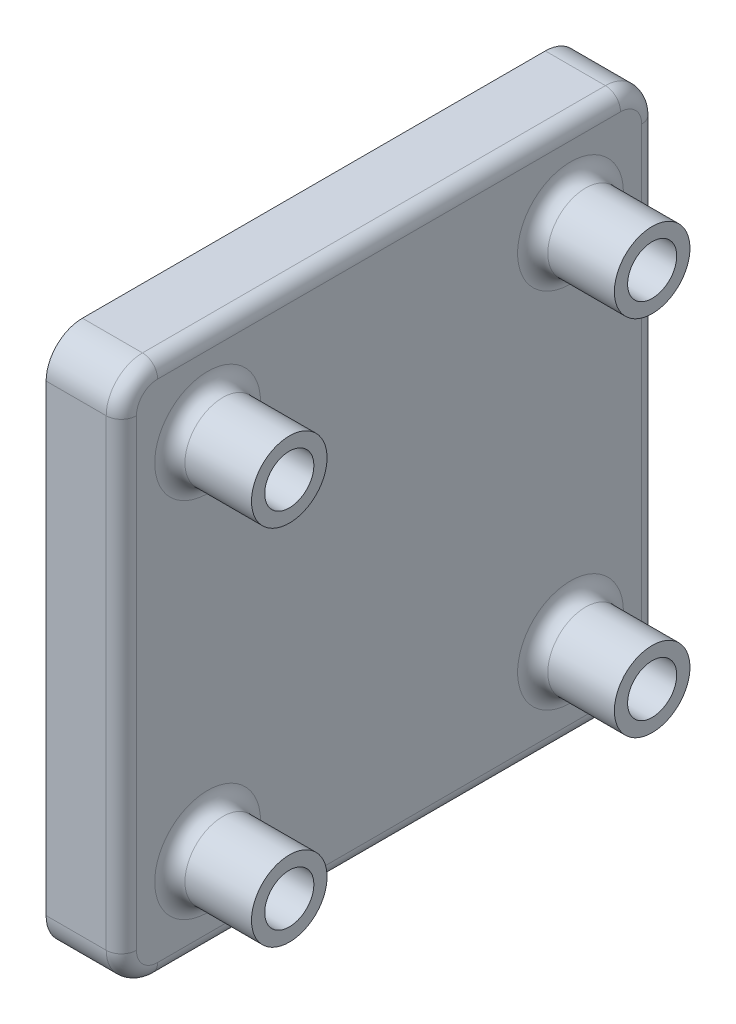
from build123d import *

# Parameters (mm, degrees)
SKETCH2_W           = 35.417007692
SKETCH2_H           = 35.417007691
SKETCH2_R           = 1.625
BOSS_EXTRUDE1_DEPTH = 4.975
SKETCH3_R           = 2.5
SKETCH3_R_2         = 1.625
BOSS_EXTRUDE2_DEPTH = 5.4
FILLET1_R           = 2.4
FILLET2_R           = 1


with BuildPart() as part:
    # Sketch2 → Boss-Extrude1 (new body)
    with BuildSketch(Plane.YZ):
        with Locations((28.194, 151.93658674)):
            Rectangle(SKETCH2_W, SKETCH2_H)
        with Locations(Location((16.194, 163.93658674, 0), (0, 0, 270))):
            Circle(SKETCH2_R, mode=Mode.SUBTRACT)
        with Locations(Location((40.194, 163.93658674, 0), (0, 0, 270))):
            Circle(SKETCH2_R, mode=Mode.SUBTRACT)
        with Locations(Location((40.194, 139.93658674, 0), (0, 0, 270))):
            Circle(SKETCH2_R, mode=Mode.SUBTRACT)
        with Locations(Location((16.194, 139.93658674, 0), (0, 0, 270))):
            Circle(SKETCH2_R, mode=Mode.SUBTRACT)
    extrude(amount=BOSS_EXTRUDE1_DEPTH)

    # Sketch3 → Boss-Extrude2 (add)
    # profile 1 of 4: a face of its own
    with BuildSketch(Plane.YZ.offset(4.975)):
        with Locations(Location((16.194, 163.93658674, 0), (0, 0, 90))):
            Circle(SKETCH3_R)
        with Locations(Location((16.194, 163.93658674, 0), (0, 0, 270))):
            Circle(SKETCH3_R_2, mode=Mode.SUBTRACT)
    # profile 2 of 4: a face of its own
    with BuildSketch(Plane.YZ.offset(4.975)):
        with Locations(Location((40.194, 163.93658674, 0), (0, 0, 90))):
            Circle(SKETCH3_R)
        with Locations(Location((40.194, 163.93658674, 0), (0, 0, 270))):
            Circle(SKETCH3_R_2, mode=Mode.SUBTRACT)
    # profile 3 of 4: a face of its own
    with BuildSketch(Plane.YZ.offset(4.975)):
        with Locations(Location((40.194, 139.93658674, 0), (0, 0, 90))):
            Circle(SKETCH3_R)
        with Locations(Location((40.194, 139.93658674, 0), (0, 0, 270))):
            Circle(SKETCH3_R_2, mode=Mode.SUBTRACT)
    # profile 4 of 4: a face of its own
    with BuildSketch(Plane.YZ.offset(4.975)):
        with Locations(Location((16.194, 139.93658674, 0), (0, 0, 90))):
            Circle(SKETCH3_R)
        with Locations(Location((16.194, 139.93658674, 0), (0, 0, 270))):
            Circle(SKETCH3_R_2, mode=Mode.SUBTRACT)
    extrude(amount=BOSS_EXTRUDE2_DEPTH)

    # Fillet1
    fillet1_edges = [part.edges().sort_by_distance(p)[0] for p in [
        (2.4875, 10.485496154, 169.645090586),
        (2.4875, 45.902503846, 169.645090586),
        (2.4875, 45.902503846, 134.228082895),
        (2.4875, 10.485496154, 134.228082895),
    ]]
    fillet(fillet1_edges, radius=FILLET1_R)

    # Fillet2
    fillet2_edges = [part.edges().sort_by_distance(p)[0] for p in [
        (4.975, 16.194, 161.43658674),
        (4.975, 40.194, 161.43658674),
        (4.975, 40.194, 137.43658674),
        (4.975, 16.194, 137.43658674),
        (4.975, 28.194, 169.645090586),
        (4.975, 45.902503846, 151.93658674),
        (4.975, 10.485496154, 151.93658674),
        (4.975, 28.194, 134.228082895),
        (4.975, 11.18843988, 168.942146861),
        (4.975, 11.18843988, 134.93102662),
        (4.975, 45.19956012, 134.93102662),
        (4.975, 45.19956012, 168.942146861),
    ]]
    fillet(fillet2_edges, radius=FILLET2_R)


solid = part.part
